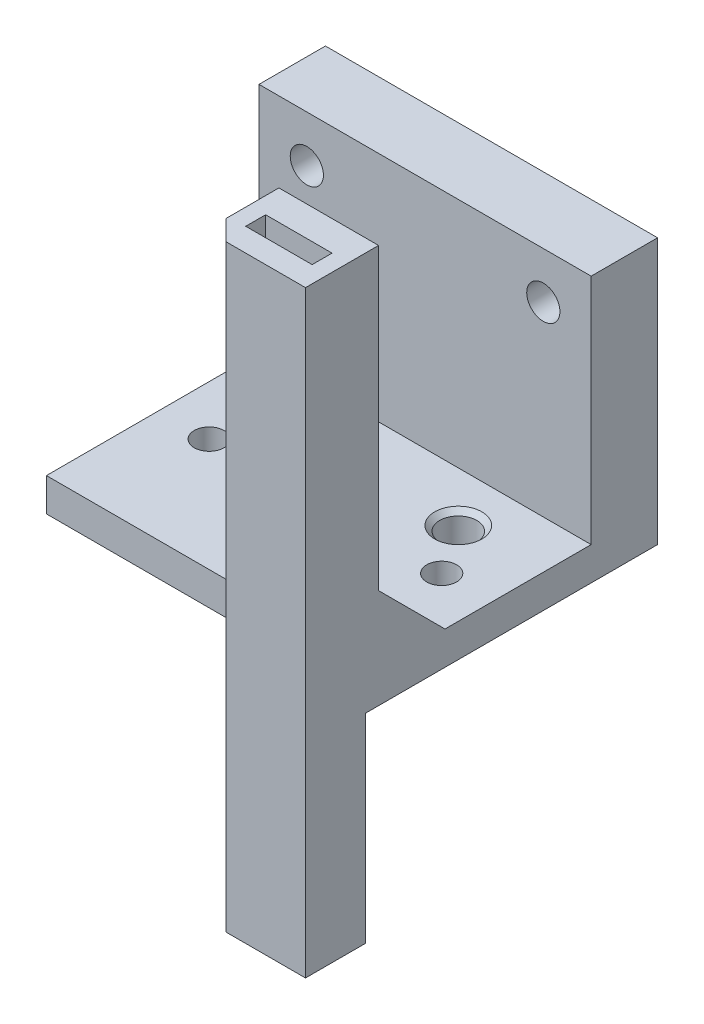
from build123d import *

# Parameters (mm, degrees)
SKETCH1_R                = 2.8
SKETCH1_R_2              = 2.25
BOSS_EXTRUDE1_DEPTH      = 5
SKETCH3_W                = 50
SKETCH3_H                = 10
BOSS_EXTRUDE3_DEPTH      = 35
SKETCH4_R                = 2.5
CUT_EXTRUDE1_DEPTH       = 64.158530699
CHAMFER1_SIZE            = 0.75
BOSS_EXTRUDE4_DEPTH      = 30
BOSS_EXTRUDE4_DEPTH_BACK = 60
SKETCH5_W                = 10
SKETCH5_H                = 3
CHAMFER2_SIZE            = 10
CHAMFER3_SIZE            = 5
SKETCH7_W                = 2
SKETCH7_H                = 30
CUT_EXTRUDE2_DEPTH       = 88.749643874


with BuildPart() as part:
    # Sketch1 → Boss-Extrude1 (new body)
    with BuildSketch(Plane(origin=(0, 0, 0), x_dir=(1, 0, 0), z_dir=(0, 1, 0))):
        Polygon((-25, 0), (-25, 40), (25, 40), (25, 0), (25, -2), (-25, -2), align=None)
        with Locations(Location((-12.5, 22.5, 0), (0, 0, 270))):
            Circle(SKETCH1_R, mode=Mode.SUBTRACT)
        with Locations(Location((12.5, 22.5, 0), (0, 0, 270))):
            Circle(SKETCH1_R, mode=Mode.SUBTRACT)
        with Locations(Location((-17.5, 15, 0), (0, 0, 270))):
            Circle(SKETCH1_R_2, mode=Mode.SUBTRACT)
        with Locations(Location((17.5, 15, 0), (0, 0, 270))):
            Circle(SKETCH1_R_2, mode=Mode.SUBTRACT)
        with Locations(Location((0, 6, 0), (0, 0, 270))):
            Circle(SKETCH1_R, mode=Mode.SUBTRACT)
    extrude(amount=BOSS_EXTRUDE1_DEPTH)

    # Sketch3 → Boss-Extrude3 (add)
    with BuildSketch(Plane(origin=(0, 5, 0), x_dir=(1, 0, 0), z_dir=(0, 1, 0))):
        with Locations((0, 35)):
            Rectangle(SKETCH3_W, SKETCH3_H)
    extrude(amount=BOSS_EXTRUDE3_DEPTH)

    # Sketch4 → Cut-Extrude1 (cut, through all)
    with BuildSketch(Plane(origin=(0, 0, -40), x_dir=(-1, 0, 0), z_dir=(0, 0, -1))):
        with Locations((-17.8, 33)):
            Circle(SKETCH4_R)
        with Locations((17.8, 33)):
            Circle(SKETCH4_R)
    extrude(amount=-CUT_EXTRUDE1_DEPTH, mode=Mode.SUBTRACT)

    # Chamfer1
    chamfer1_edges = [part.edges().sort_by_distance(p)[0] for p in [
        (-12.5, 5, -25.3),
        (12.5, 5, -25.3),
        (0, 5, -8.8),
    ]]
    chamfer(chamfer1_edges, length=CHAMFER1_SIZE)

    # Sketch5 → Boss-Extrude4 (add, two sides: drawn at the far end of the back side and taken through both)
    with BuildSketch(Plane.XZ.offset(-BOSS_EXTRUDE4_DEPTH_BACK)):
        Polygon((13, 13), (10, 10), (10, 2), (25, 2), (25, 13), align=None)
        with Locations((17.5, 8)):
            Rectangle(SKETCH5_W, SKETCH5_H, mode=Mode.SUBTRACT)
    extrude(amount=BOSS_EXTRUDE4_DEPTH + BOSS_EXTRUDE4_DEPTH_BACK)

    # Chamfer2
    chamfer2_edges = [part.edges().sort_by_distance(p)[0] for p in [
        (17.5, 5, 2),
    ]]
    chamfer(chamfer2_edges, length=CHAMFER2_SIZE)

    # Chamfer3
    chamfer3_edges = [part.edges().sort_by_distance(p)[0] for p in [
        (10, 2.5, 2),
        (10, 5, -3),
    ]]
    chamfer(chamfer3_edges, length=CHAMFER3_SIZE)

    # Sketch7 → Cut-Extrude2 (cut, through all)
    with BuildSketch(Plane(origin=(25, 0, 0), x_dir=(0, 0, -1), z_dir=(1, 0, 0))):
        with Locations((-3, -15)):
            Rectangle(SKETCH7_W, SKETCH7_H)
    extrude(amount=-CUT_EXTRUDE2_DEPTH, mode=Mode.SUBTRACT)


solid = part.part
